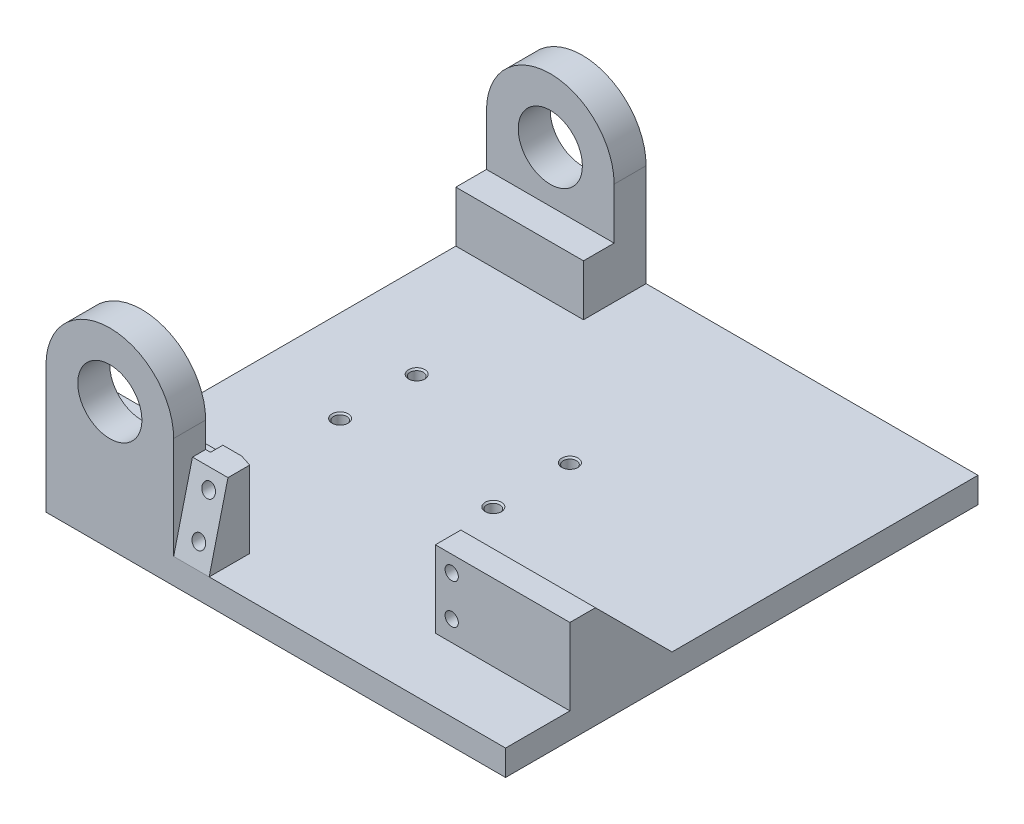
from build123d import *
from build123d.topology import SkipClean

# Parameters (mm, degrees)
SKETCH2_R                       = 7.9756
BOSS_EXTRUDE1_DEPTH             = 7.9502
SKETCH3_W                       = 107.95
SKETCH3_H                       = 6.35
BOSS_EXTRUDE2_DEPTH             = 101.6
SKETCH4_R                       = 7.9756
BOSS_EXTRUDE3_DEPTH             = 7.9502
SKETCH5_W                       = 117.5004
SKETCH5_H                       = 6.35
BOSS_EXTRUDE4_DEPTH             = 6.35
SKETCH6_W                       = 33.463288309
SKETCH6_H                       = 6.35
BOSS_EXTRUDE5_DEPTH             = 19.05
BOSS_EXTRUDE6_START             = -33.463288
BOSS_EXTRUDE6_DEPTH             = 33.463288
BOSS_EXTRUDE8_DEPTH             = 8.83271
M4X0_7_TAPPED_HOLE1_D           = 3.3
M4X0_7_TAPPED_HOLE1_CSINK_D     = 4.05
M4X0_7_TAPPED_HOLE1_CSINK_ANGLE = 90
CUT_EXTRUDE1_REACH              = 124.266
SKETCH15_R                      = 1.651
CUT_EXTRUDE2_REACH              = 128.428
SKETCH18_R                      = 1.651
SKETCH19_W                      = 7.62
SKETCH19_H                      = 12.7
BOSS_EXTRUDE9_DEPTH             = 31.75


with BuildPart() as part:
    # Sketch2 → Boss-Extrude1 (new body)
    with BuildSketch(Plane.XY):
        with BuildLine():
            Line((-22.225, -25.4), (-22.225, 0))
            ThreePointArc((-22.225, 0), (-38.1, 15.875), (-53.975, 0))
            Line((-53.975, 0), (-53.975, -31.75))
            Line((-53.975, -31.75), (53.975, -31.75))
            Line((53.975, -31.75), (53.975, -25.4))
            Line((53.975, -25.4), (22.225, -25.4))
            Line((22.225, -25.4), (-22.225, -25.4))
        make_face()
        with Locations((-38.1, 0)):
            Circle(SKETCH2_R, mode=Mode.SUBTRACT)
    extrude(amount=BOSS_EXTRUDE1_DEPTH)

    # Sketch3 → Boss-Extrude2 (add)
    with BuildSketch(Plane.XY.offset(7.9502)):
        with Locations((0, -28.575)):
            Rectangle(SKETCH3_W, SKETCH3_H)
    extrude(amount=BOSS_EXTRUDE2_DEPTH)

    # Sketch4 → Boss-Extrude3 (add)
    with BuildSketch(Plane.XY.offset(109.5502)):
        with BuildLine():
            Line((-53.975, 0), (-53.975, -31.75))
            Line((-53.975, -31.75), (53.975, -31.75))
            Line((53.975, -31.75), (53.975, -25.4))
            Line((53.975, -25.4), (-22.225, -25.4))
            Line((-22.225, -25.4), (-22.225, 0))
            ThreePointArc((-22.225, 0), (-38.1, 15.875), (-53.975, 0))
        make_face()
        with Locations((-38.1, 0)):
            Circle(SKETCH4_R, mode=Mode.SUBTRACT)
    extrude(amount=BOSS_EXTRUDE3_DEPTH)

    # Sketch5 → Boss-Extrude4 (add)
    with BuildSketch(Plane(origin=(53.975, 0, 0), x_dir=(0, 0, -1), z_dir=(1, 0, 0))):
        with Locations((-58.7502, -28.575)):
            Rectangle(SKETCH5_W, SKETCH5_H)
    extrude(amount=BOSS_EXTRUDE4_DEPTH)

    # Sketch6 → Boss-Extrude5 (add)
    with BuildSketch(Plane(origin=(0, -25.4, 0), x_dir=(1, 0, 0), z_dir=(0, 1, 0))):
        with Locations((43.593355845, -98.3234)):
            Rectangle(SKETCH6_W, SKETCH6_H)
        Polygon((-13.392288309, -112.8252), (-13.392288309, -107.418332231), (-16.329801264, -106.4752), (-21.012288309, -106.4752), (-21.012288309, -109.5502), (-22.225, -109.5502), (-22.225, -112.8252), align=None)
    extrude(amount=BOSS_EXTRUDE5_DEPTH)

    # Sketch8 → Boss-Extrude6 (add)
    with SkipClean():  # the faces are left unmerged after this step: merging them gives an invalid solid
        with BuildSketch(Plane(origin=(60.325, 0, 0), x_dir=(0, 0, -1), z_dir=(1, 0, 0)).offset(BOSS_EXTRUDE6_START)):
            Polygon((-95.1484, -6.35), (-76.0984, -25.4), (-95.1484, -25.4), align=None)
        extrude(amount=BOSS_EXTRUDE6_DEPTH)

    # Sketch10 → Boss-Extrude8 (add)
    with SkipClean():  # the faces are left unmerged after this step: merging them gives an invalid solid
        with BuildSketch(Plane(origin=(-22.225, 0, 0), x_dir=(0, 0, -1), z_dir=(1, 0, 0))):
            Polygon((-112.8252, -6.35), (-117.5004, -25.4), (-112.8252, -25.4), align=None)
        extrude(amount=BOSS_EXTRUDE8_DEPTH)

    # M4x0.7 Tapped Hole1 (through all)
    with Locations(Plane(origin=(0, -25.4, 0), x_dir=(1, 0, 0), z_dir=(0, 1, 0))):
        with Locations((6.876306211, -48.0502), (6.876306211, -67.1002), (-31.223693789, -67.1002), (-31.223693789, -48.0502)):
            CounterSinkHole(M4X0_7_TAPPED_HOLE1_D / 2, M4X0_7_TAPPED_HOLE1_CSINK_D / 2, counter_sink_angle=M4X0_7_TAPPED_HOLE1_CSINK_ANGLE)

    # Cut-Extrude1: up to this plane
    with SkipClean():  # the faces are left unmerged after this step: merging them gives an invalid solid
        cut_extrude1_end = Plane(origin=(26.861711691, -6.35, 95.1484), z_dir=(0, 0.7071067811865517, -0.7071067811865435))
        # Sketch15 → Cut-Extrude1 (cut, up to the surface)
        with BuildSketch(Plane.XY.offset(101.4984), mode=Mode.PRIVATE) as cut_extrude1_sk1:
            with Locations((30.925711691, -10.414)):
                Circle(SKETCH15_R)
        cut_extrude1_tool1 = split(extrude(cut_extrude1_sk1.sketch, amount=-CUT_EXTRUDE1_REACH, mode=Mode.PRIVATE), bisect_by=cut_extrude1_end, keep=Keep.BOTH, mode=Mode.PRIVATE)
        add(cut_extrude1_tool1.solids().sort_by_distance((30.925712, -10.414, 101.4984))[0], mode=Mode.SUBTRACT)
        # Sketch15 → Cut-Extrude1 (cut, up to the surface)
        with BuildSketch(Plane.XY.offset(101.4984), mode=Mode.PRIVATE) as cut_extrude1_sk2:
            with Locations((30.925711691, -20.32)):
                Circle(SKETCH15_R)
        cut_extrude1_tool2 = split(extrude(cut_extrude1_sk2.sketch, amount=-CUT_EXTRUDE1_REACH, mode=Mode.PRIVATE), bisect_by=cut_extrude1_end, keep=Keep.BOTH, mode=Mode.PRIVATE)
        add(cut_extrude1_tool2.solids().sort_by_distance((30.925712, -20.32, 101.4984))[0], mode=Mode.SUBTRACT)

    # Cut-Extrude2: up to this plane
    with SkipClean():  # the faces are left unmerged after this step: merging them gives an invalid solid
        cut_extrude2_end = Plane(origin=(-13.392288309, -6.35, 112.8252), z_dir=(0, -0.23834455727061551, -0.9711806587960216))
        # Sketch18 → Cut-Extrude2 (cut, up to the surface)
        with BuildSketch(Plane(origin=(0, 0, 106.4752), x_dir=(-1, 0, 0), z_dir=(0, 0, -1)), mode=Mode.PRIVATE) as cut_extrude2_sk1:
            with Locations(Location((17.202288309, -10.414, 0), (0, 0, 90))):
                Circle(SKETCH18_R)
        cut_extrude2_tool1 = split(extrude(cut_extrude2_sk1.sketch, amount=-CUT_EXTRUDE2_REACH, mode=Mode.PRIVATE), bisect_by=cut_extrude2_end, keep=Keep.BOTH, mode=Mode.PRIVATE)
        add(cut_extrude2_tool1.solids().sort_by_distance((-17.202288, -10.414, 106.4752))[0], mode=Mode.SUBTRACT)
        # Sketch18 → Cut-Extrude2 (cut, up to the surface)
        with BuildSketch(Plane(origin=(0, 0, 106.4752), x_dir=(-1, 0, 0), z_dir=(0, 0, -1)), mode=Mode.PRIVATE) as cut_extrude2_sk2:
            with Locations(Location((17.202288309, -20.32, 0), (0, 0, 90))):
                Circle(SKETCH18_R)
        cut_extrude2_tool2 = split(extrude(cut_extrude2_sk2.sketch, amount=-CUT_EXTRUDE2_REACH, mode=Mode.PRIVATE), bisect_by=cut_extrude2_end, keep=Keep.BOTH, mode=Mode.PRIVATE)
        add(cut_extrude2_tool2.solids().sort_by_distance((-17.202288, -20.32, 106.4752))[0], mode=Mode.SUBTRACT)

    # Sketch19 → Boss-Extrude9 (add)
    with SkipClean():  # the faces are left unmerged after this step: merging them gives an invalid solid
        with BuildSketch(Plane.ZY.offset(53.975)):
            with Locations((11.7602, -19.05)):
                Rectangle(SKETCH19_W, SKETCH19_H)
            with Locations((105.7402, -19.05)):
                Rectangle(SKETCH19_W, SKETCH19_H)
        extrude(amount=-BOSS_EXTRUDE9_DEPTH)


solid = part.part
